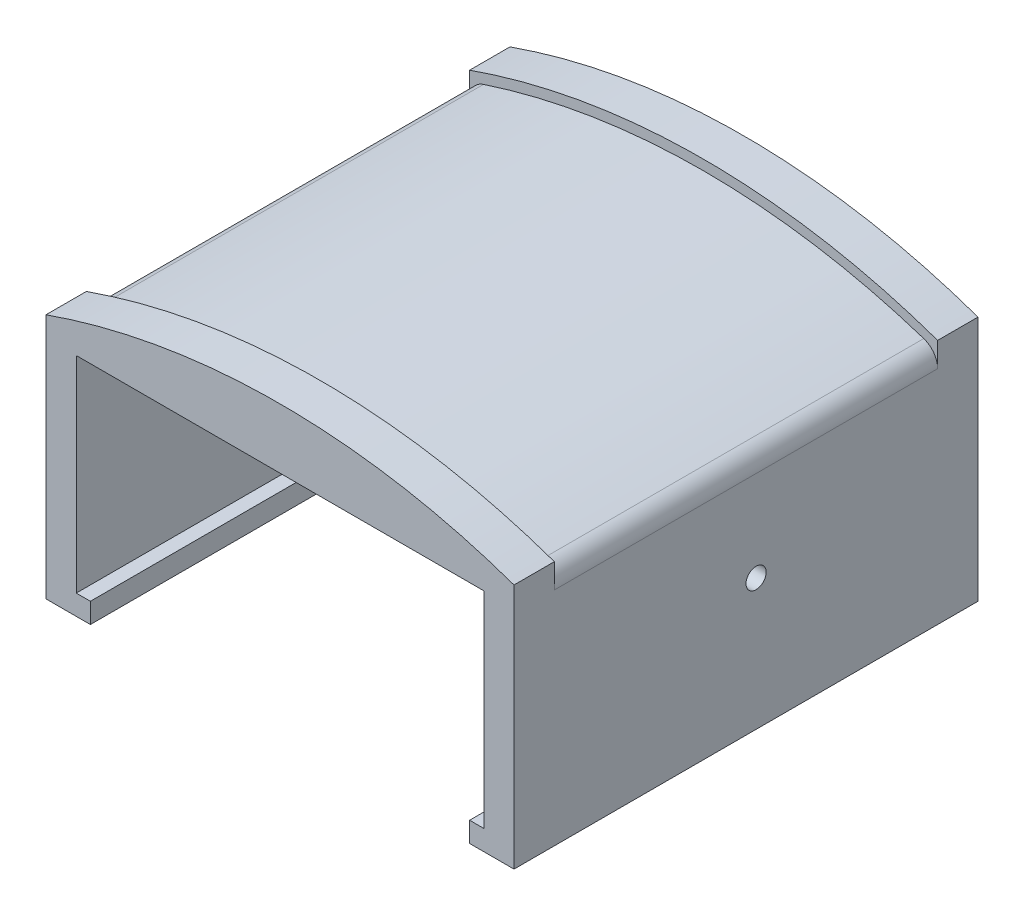
from build123d import *

# Parameters (mm, degrees)
BOSS_EXTRUDE1_DEPTH = 25.4
BOSS_EXTRUDE2_DEPTH = 5.08
LPATTERN1_COUNT     = 2
LPATTERN1_PITCH     = 53.34
FILLET7_R           = 2.54
SKETCH4_R           = 1.27
CUT_EXTRUDE1_DEPTH  = 73.186067132


with BuildPart() as part:
    # Sketch1 → Boss-Extrude1 (new, symmetric)
    with BuildSketch(Plane.XY):
        with BuildLine():
            Line((-25.654, 0), (25.654, 0))
            Line((25.654, 0), (25.654, -25.908))
            Line((25.654, -25.908), (23.876, -25.908))
            Line((23.876, -25.908), (23.876, -28.448))
            Line((23.876, -28.448), (29.464, -28.448))
            Line((29.464, -28.448), (29.464, 1.27))
            ThreePointArc((29.464, 1.27), (0, 6.294600126), (-29.464, 1.27))
            Line((-29.464, 1.27), (-29.464, -28.448))
            Line((-29.464, -28.448), (-23.876, -28.448))
            Line((-23.876, -28.448), (-23.876, -25.908))
            Line((-23.876, -25.908), (-25.654, -25.908))
            Line((-25.654, -25.908), (-25.654, 0))
        make_face()
    extrude(amount=BOSS_EXTRUDE1_DEPTH, both=True)

    # Sketch2 → Boss-Extrude2 (add)
    with BuildSketch(Plane.XY.offset(25.4)):
        with BuildLine():
            Line((29.464, -28.448), (29.464, 2.54))
            ThreePointArc((29.464, 2.54), (0, 7.564600126), (-29.464, 2.54))
            Line((-29.464, 2.54), (-29.464, -28.448))
            Line((-29.464, -28.448), (-23.876, -28.448))
            Line((-23.876, -28.448), (-23.876, -25.908))
            Line((-23.876, -25.908), (-25.654, -25.908))
            Line((-25.654, -25.908), (-25.654, 0))
            Line((-25.654, 0), (25.654, 0))
            Line((25.654, 0), (25.654, -25.908))
            Line((25.654, -25.908), (23.876, -25.908))
            Line((23.876, -25.908), (23.876, -28.448))
            Line((23.876, -28.448), (29.464, -28.448))
        make_face()
    boss_extrude2 = extrude(amount=BOSS_EXTRUDE2_DEPTH)

    # LPattern1: Boss-Extrude2 ×2
    with Locations(*[(0, 0, -i * LPATTERN1_PITCH) for i in range(1, LPATTERN1_COUNT)]):
        add(boss_extrude2)

    # Fillet7
    fillet7_edges = [part.edges().sort_by_distance(p)[0] for p in [
        (-29.464, 1.27, 1.27),
        (29.464, 1.27, 1.27),
    ]]
    fillet(fillet7_edges, radius=FILLET7_R)

    # Sketch4 → Cut-Extrude1 (cut, through all)
    with BuildSketch(Plane.ZY.offset(29.464)):
        with Locations((0, -11.938)):
            Circle(SKETCH4_R)
    extrude(amount=-CUT_EXTRUDE1_DEPTH, mode=Mode.SUBTRACT)


solid = part.part
